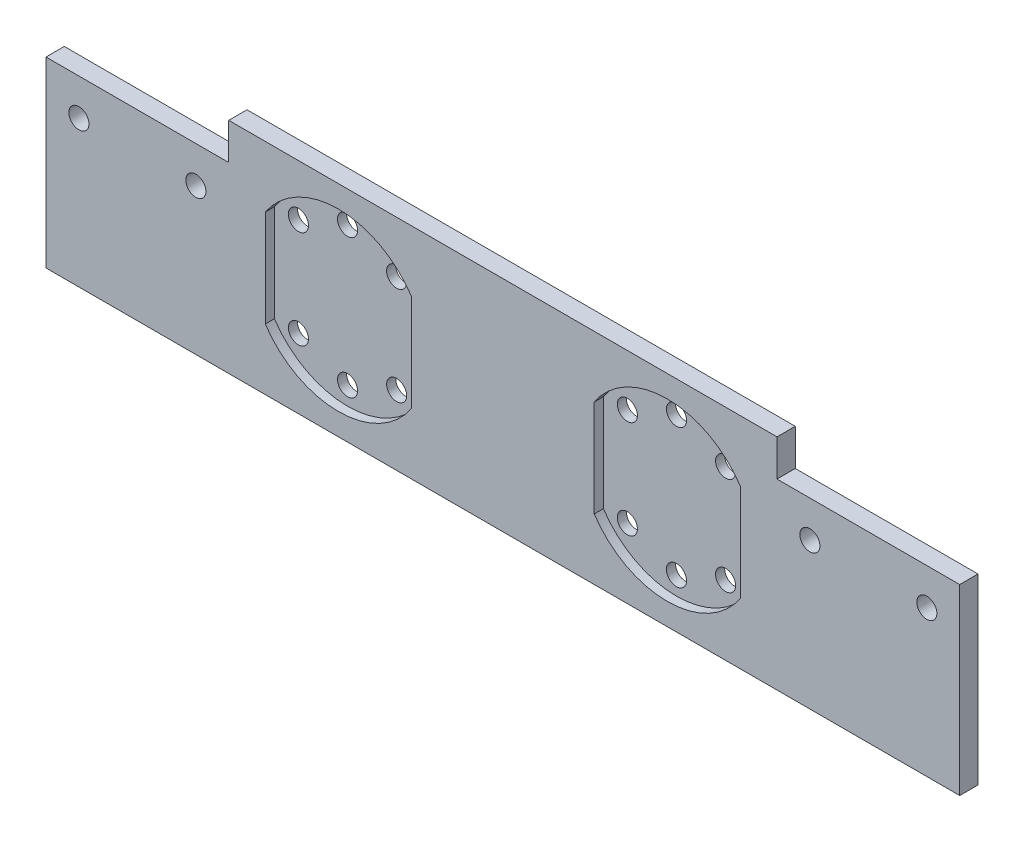
from build123d import *

# Parameters (mm, degrees)
SKETCH_1_W          = 290
SKETCH_1_H          = 50
EXTRUDE_1_DEPTH     = 5
SKETCH_3_W          = 20
SKETCH_3_H          = 50
CUT_EXTRUDE_1_DEPTH = 10
SKETCH_4_W          = 150
SKETCH_4_H          = 5
EXTRUDE_2_DEPTH     = 10
SKETCH_2_R          = 2.75
CUT_EXTRUDE_2_DEPTH = 2.5
SKETCH_2_2_R        = 2.75
CUT_EXTRUDE_3_DEPTH = 130.903810568
SKETCH_5_R          = 2.75
CUT_EXTRUDE_4_DEPTH = 130.903810568


with BuildPart() as part:
    # 스케치1 → 보스-돌출1 (new body)
    with BuildSketch(Plane.XY):
        Rectangle(SKETCH_1_W, SKETCH_1_H)
    extrude(amount=EXTRUDE_1_DEPTH)

    # 스케치3 → 컷-돌출1 (cut)
    with BuildSketch(Plane.XY.offset(5)):
        with Locations((-135, 0)):
            Rectangle(SKETCH_3_W, SKETCH_3_H)
    cut_extrude_1 = extrude(amount=-CUT_EXTRUDE_1_DEPTH, mode=Mode.SUBTRACT)

    # 대칭 복사1: 컷-돌출1 across plane
    add(cut_extrude_1.mirror(Plane(origin=(0, 0, 0), x_dir=(0, 0, 1), z_dir=(1, 0, 0))), mode=Mode.SUBTRACT)

    # 스케치4 → 보스-돌출2 (add)
    with BuildSketch(Plane(origin=(0, 25, 0), x_dir=(1, 0, 0), z_dir=(0, 1, 0))):
        with Locations((0, -2.5)):
            Rectangle(SKETCH_4_W, SKETCH_4_H)
    extrude(amount=EXTRUDE_2_DEPTH)

    # 스케치2 → 컷-돌출2 (cut)
    # profile 1 of 2: a face of its own
    with BuildSketch(Plane.XY.offset(5)):
        with BuildLine():
            Line((65, 18.26), (65, -8.27))
            ThreePointArc((65, -8.27), (45.000804497, -19.004999933), (25, -8.272998079))
            Line((25, -8.272998079), (25, 18.262998079))
            ThreePointArc((25, 18.262998079), (45.000804497, 28.994999933), (65, 18.26))
        make_face()
        with Locations((58.44, -8.437)):
            Circle(SKETCH_2_R, mode=Mode.SUBTRACT)
        with Locations((31.558011299, -8.437)):
            Circle(SKETCH_2_R, mode=Mode.SUBTRACT)
        with Locations((44.99900565, -14)):
            Circle(SKETCH_2_R, mode=Mode.SUBTRACT)
        with Locations((58.44, 18.427)):
            Circle(SKETCH_2_R, mode=Mode.SUBTRACT)
        with Locations((44.99900565, 23.99)):
            Circle(SKETCH_2_R, mode=Mode.SUBTRACT)
        with Locations((31.558011299, 18.427)):
            Circle(SKETCH_2_R, mode=Mode.SUBTRACT)
    # profile 2 of 2: a face of its own
    with BuildSketch(Plane.XY.offset(5)):
        with BuildLine():
            Line((-25, 18.262998079), (-25, -8.272998079))
            ThreePointArc((-25, -8.272998079), (-45.000804497, -19.004999933), (-65, -8.27))
            Line((-65, -8.27), (-65, 18.26))
            ThreePointArc((-65, 18.26), (-45.000804497, 28.994999933), (-25, 18.262998079))
        make_face()
        with Locations((-31.558011299, 18.427)):
            Circle(SKETCH_2_R, mode=Mode.SUBTRACT)
        with Locations((-44.99900565, 23.99)):
            Circle(SKETCH_2_R, mode=Mode.SUBTRACT)
        with Locations((-58.44, 18.427)):
            Circle(SKETCH_2_R, mode=Mode.SUBTRACT)
        with Locations((-44.99900565, -14)):
            Circle(SKETCH_2_R, mode=Mode.SUBTRACT)
        with Locations((-31.558011299, -8.437)):
            Circle(SKETCH_2_R, mode=Mode.SUBTRACT)
        with Locations((-58.44, -8.437)):
            Circle(SKETCH_2_R, mode=Mode.SUBTRACT)
    extrude(amount=-CUT_EXTRUDE_2_DEPTH, mode=Mode.SUBTRACT)

    # 스케치2<2> → 컷-돌출3 (cut, through all)
    with BuildSketch(Plane.XY.offset(5)):
        with Locations((58.44, -8.437)):
            Circle(SKETCH_2_2_R)
        with Locations((31.558011299, -8.437)):
            Circle(SKETCH_2_2_R)
        with Locations((44.99900565, -14)):
            Circle(SKETCH_2_2_R)
        with Locations((58.44, 18.427)):
            Circle(SKETCH_2_2_R)
        with Locations((44.99900565, 23.99)):
            Circle(SKETCH_2_2_R)
        with Locations((31.558011299, 18.427)):
            Circle(SKETCH_2_2_R)
        with Locations((-31.558011299, 18.427)):
            Circle(SKETCH_2_2_R)
        with Locations((-44.99900565, 23.99)):
            Circle(SKETCH_2_2_R)
        with Locations((-58.44, 18.427)):
            Circle(SKETCH_2_2_R)
        with Locations((-44.99900565, -14)):
            Circle(SKETCH_2_2_R)
        with Locations((-31.558011299, -8.437)):
            Circle(SKETCH_2_2_R)
        with Locations((-58.44, -8.437)):
            Circle(SKETCH_2_2_R)
    extrude(amount=-CUT_EXTRUDE_3_DEPTH, mode=Mode.SUBTRACT)

    # 스케치5 → 컷-돌출4 (cut, through all)
    with BuildSketch(Plane.XY.offset(5)):
        with Locations((-84, 15)):
            Circle(SKETCH_5_R)
        with Locations((-116, 15)):
            Circle(SKETCH_5_R)
        with Locations((116, 15)):
            Circle(SKETCH_5_R)
        with Locations((84, 15)):
            Circle(SKETCH_5_R)
    extrude(amount=-CUT_EXTRUDE_4_DEPTH, mode=Mode.SUBTRACT)


solid = part.part
